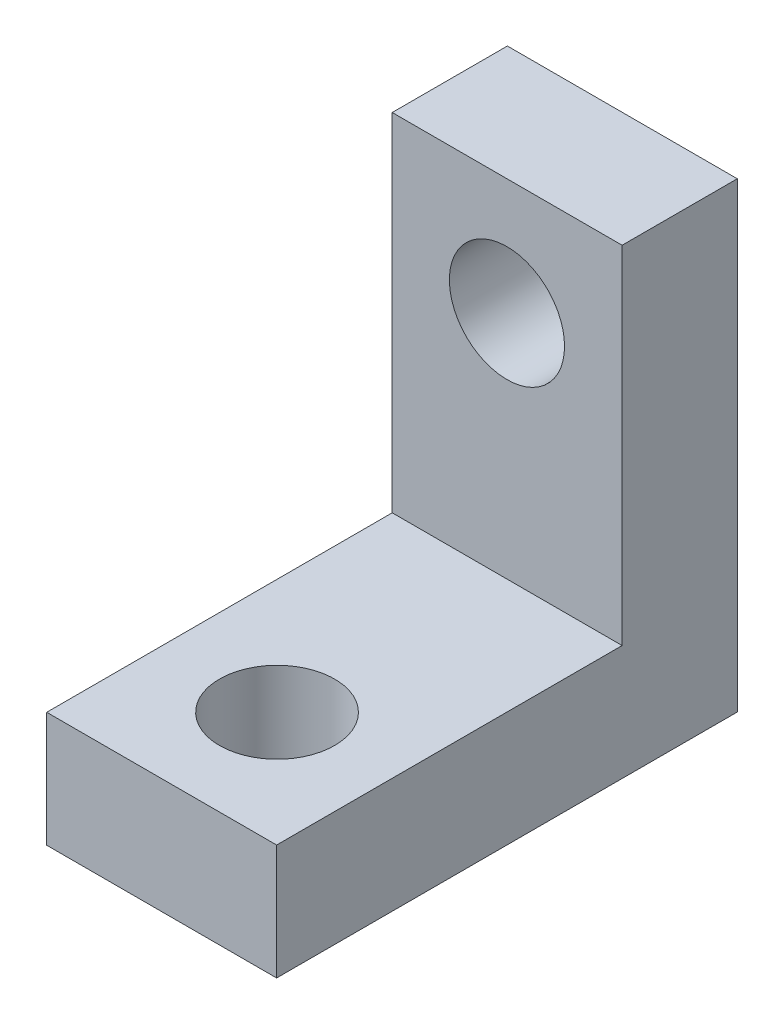
from build123d import *

# Parameters (mm, degrees)
SKETCH1_R           = 3.175
BOSS_EXTRUDE1_DEPTH = 6.35
SKETCH2_W           = 12.676867833
SKETCH2_H           = 6.35
BOSS_EXTRUDE2_DEPTH = 19.05
SKETCH3_R           = 3.175
CUT_EXTRUDE1_DEPTH  = 19.05


with BuildPart() as part:
    # Sketch1 → Boss-Extrude1 (new body)
    with BuildSketch(Plane.XY):
        Polygon((-6.326867833, 0), (-6.326867833, -19.05), (6.35, -19.05), (6.35, 0), (6.35, 6.415574662), (-6.326867833, 6.415574662), align=None)
        Circle(SKETCH1_R, mode=Mode.SUBTRACT)
    extrude(amount=BOSS_EXTRUDE1_DEPTH)

    # Sketch2 → Boss-Extrude2 (add)
    with BuildSketch(Plane.XY.offset(6.35)):
        with Locations((0.011566083, -15.875)):
            Rectangle(SKETCH2_W, SKETCH2_H)
    extrude(amount=BOSS_EXTRUDE2_DEPTH)

    # Sketch3 → Cut-Extrude1 (cut)
    with BuildSketch(Plane(origin=(0, -12.7, 0), x_dir=(1, 0, 0), z_dir=(0, 1, 0))):
        with Locations(Location((0.023132167, -19.05, 0), (0, 0, 270))):
            Circle(SKETCH3_R)
    extrude(amount=-CUT_EXTRUDE1_DEPTH, mode=Mode.SUBTRACT)


solid = part.part
